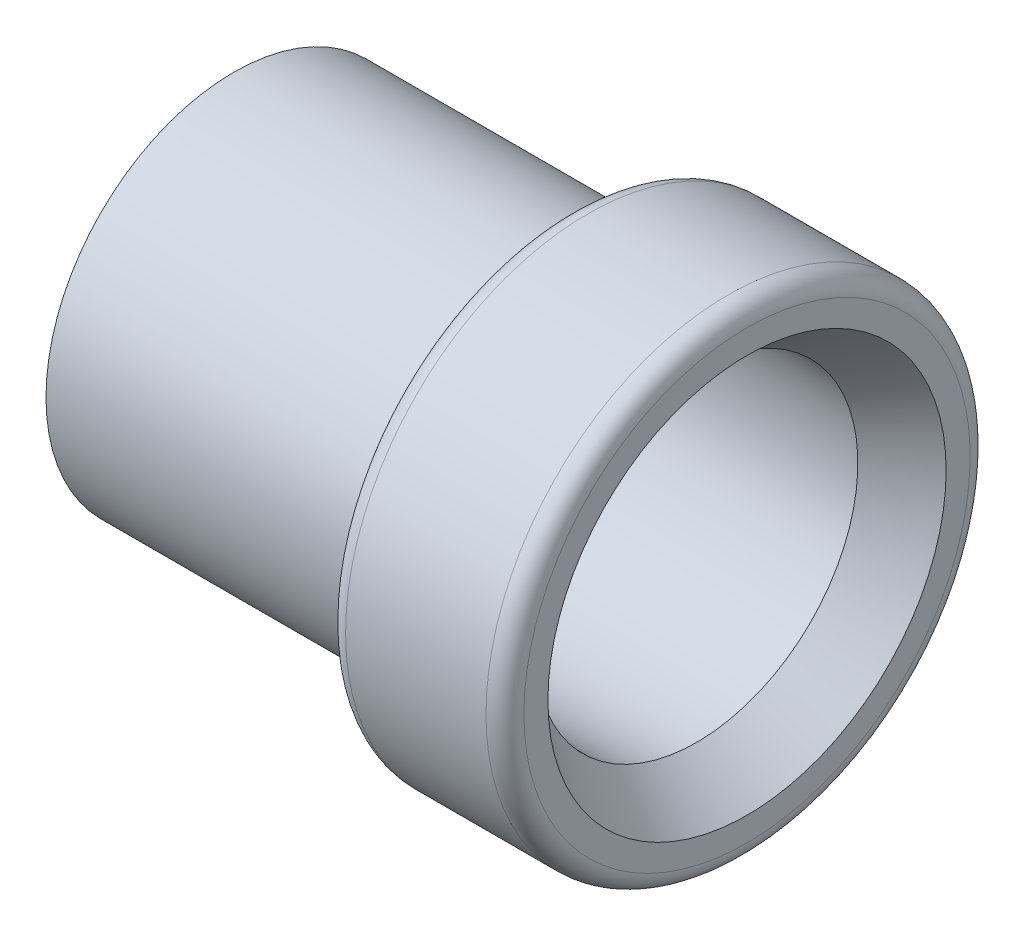
from build123d import *


with BuildPart() as part:
    # Sketch1 → Revolve1 (revolve)
    with BuildSketch(Plane.XY, mode=Mode.PRIVATE) as revolve1_sk:
        with BuildLine():
            Line((-5.1562, 3.2385), (4.144991846, 3.2385))
            Line((4.144991846, 3.2385), (5.1562, 4.0005))
            Line((5.1562, 4.0005), (5.1562, 4.4831))
            ThreePointArc((5.1562, 4.4831), (5.044607684, 4.752507684), (4.7752, 4.8641))
            Line((4.7752, 4.8641), (1.9558, 4.8641))
            ThreePointArc((1.9558, 4.8641), (1.686392316, 4.752507684), (1.5748, 4.4831))
            Line((1.5748, 4.4831), (1.5748, 3.7719))
            Line((1.5748, 3.7719), (-5.1562, 3.7719))
            Line((-5.1562, 3.7719), (-5.1562, 3.2385))
        make_face()
    revolve(revolve1_sk.sketch.rotate(Axis((-5.1562, 0, 0), (1, 0, 0)), 90), axis=Axis((-5.1562, 0, 0), (1, 0, 0)))


solid = part.part
